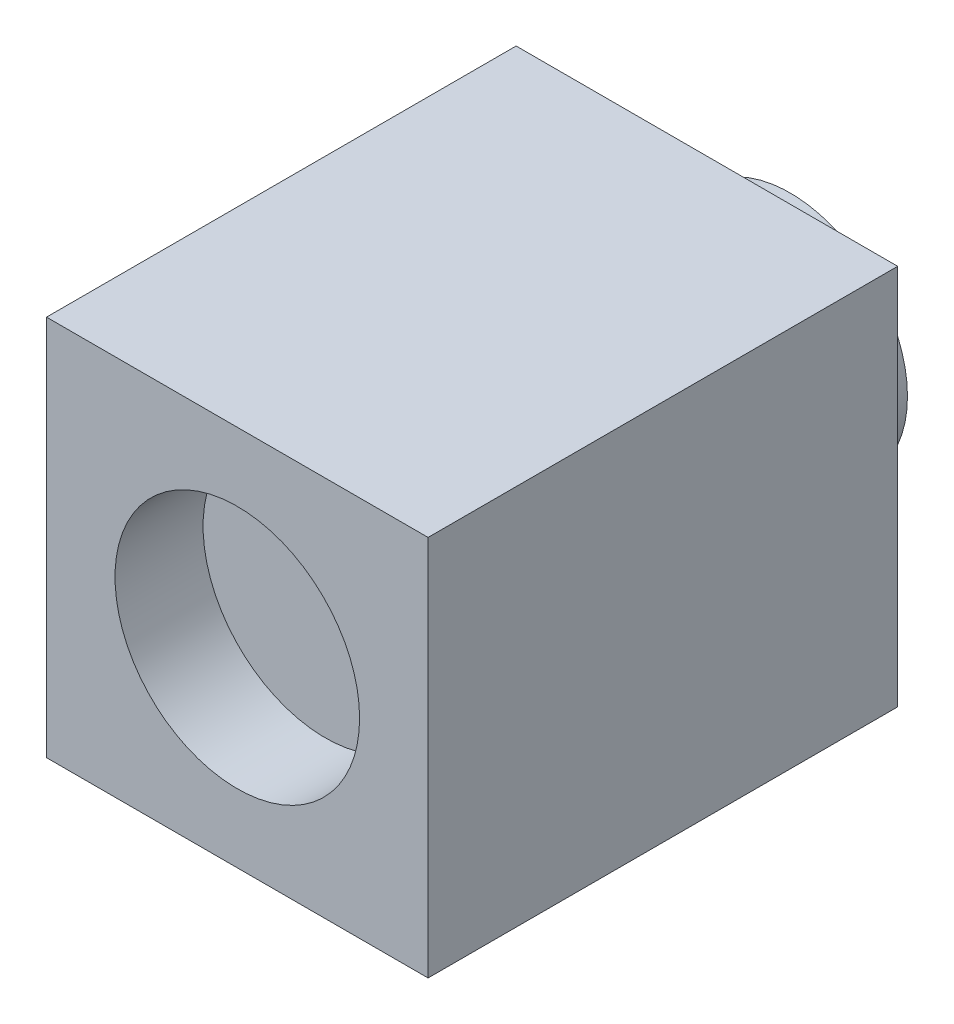
from build123d import *

# Parameters (mm, degrees)
SKETCH_1_W          = 7.8
SKETCH_1_H          = 7.8
EXTRUDE_1_DEPTH     = 9.6
SKETCH_2_R          = 2.4
EXTRUDE_2_DEPTH     = 1.7
SKETCH_3_R          = 2.5
CUT_EXTRUDE_1_DEPTH = 1.8


with BuildPart() as part:
    # Эскиз1 → Бобышка-Вытянуть1 (new body)
    with BuildSketch(Plane.XY):
        Rectangle(SKETCH_1_W, SKETCH_1_H)
    extrude(amount=EXTRUDE_1_DEPTH)

    # Эскиз2 → Бобышка-Вытянуть2 (add)
    with BuildSketch(Plane(origin=(0, 0, 0), x_dir=(-1, 0, 0), z_dir=(0, 0, -1))):
        Circle(SKETCH_2_R)
    extrude(amount=EXTRUDE_2_DEPTH)

    # Эскиз3 → Вырез-Вытянуть1 (cut)
    with BuildSketch(Plane.XY.offset(9.6)):
        Circle(SKETCH_3_R)
    extrude(amount=-CUT_EXTRUDE_1_DEPTH, mode=Mode.SUBTRACT)


solid = part.part
